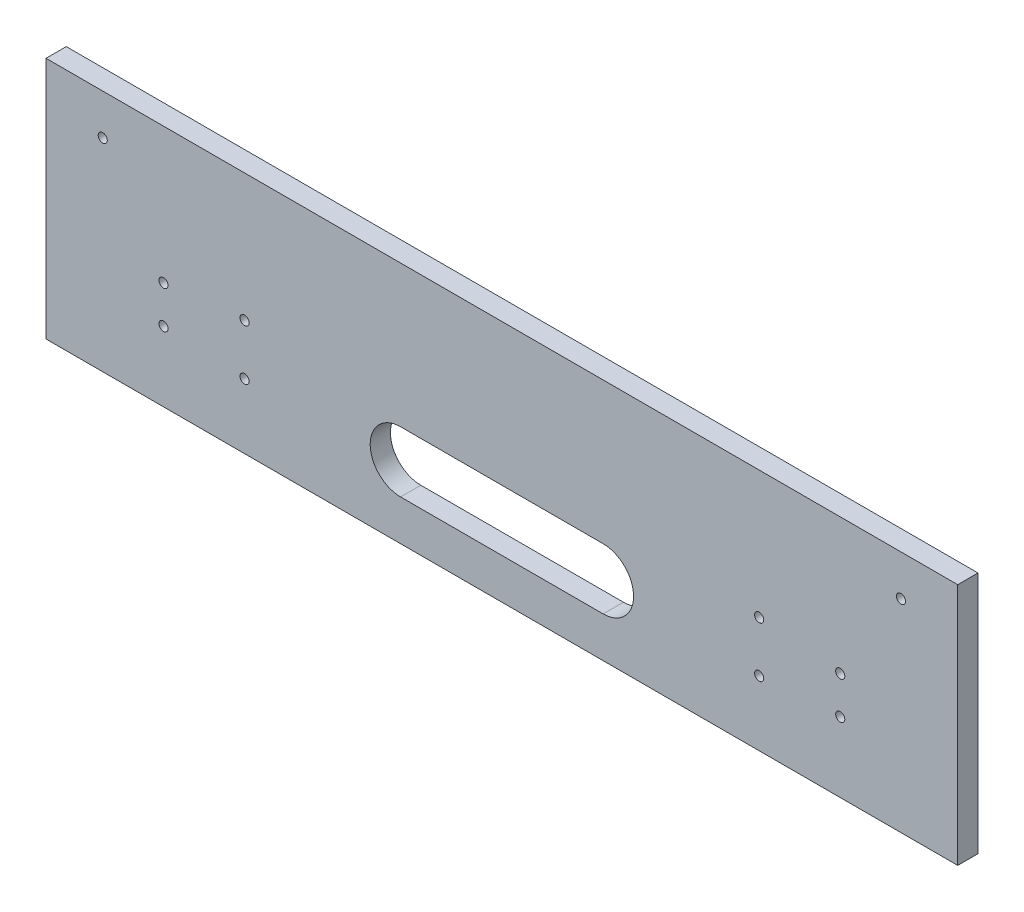
from build123d import *

# Parameters (mm, degrees)
SCHIZZO1_W                   = 450
SCHIZZO1_H                   = 120
ESTRUSIONE_ESTRUSIONE1_DEPTH = 10
TAGLIO_ESTRUSIONE1_DEPTH     = 10
SCHIZZO3_R                   = 2.25
TAGLIO_ESTRUSIONE2_DEPTH     = 10
SCHIZZO4_R                   = 2.25
TAGLIO_ESTRUSIONE3_DEPTH     = 10


with BuildPart() as part:
    # Schizzo1 → Estrusione-Estrusione1 (new body)
    with BuildSketch(Plane.XY):
        Rectangle(SCHIZZO1_W, SCHIZZO1_H)
    extrude(amount=ESTRUSIONE_ESTRUSIONE1_DEPTH)

    # Schizzo2 → Taglio-Estrusione1 (cut)
    with BuildSketch(Plane.XY.offset(10)):
        with BuildLine():
            Line((-50, -10), (50, -10))
            ThreePointArc((50, -10), (65, -25), (50, -40))
            Line((50, -40), (-50, -40))
            ThreePointArc((-50, -40), (-65, -25), (-50, -10))
        make_face()
    extrude(amount=-TAGLIO_ESTRUSIONE1_DEPTH, mode=Mode.SUBTRACT)

    # Schizzo3 → Taglio-Estrusione2 (cut)
    with BuildSketch(Plane(origin=(0, 0, 0), x_dir=(-1, 0, 0), z_dir=(0, 0, -1))):
        with Locations((-167, -7)):
            Circle(SCHIZZO3_R)
        with Locations((-167, -25.5)):
            Circle(SCHIZZO3_R)
        with Locations((167, -7)):
            Circle(SCHIZZO3_R)
        with Locations((167, -25.5)):
            Circle(SCHIZZO3_R)
        with Locations((197, 40)):
            Circle(SCHIZZO3_R)
        with Locations((-197, 40)):
            Circle(SCHIZZO3_R)
    extrude(amount=-TAGLIO_ESTRUSIONE2_DEPTH, mode=Mode.SUBTRACT)

    # Schizzo4 → Taglio-Estrusione3 (cut)
    with BuildSketch(Plane.XY.offset(10)):
        with Locations((-127, -3)):
            Circle(SCHIZZO4_R)
        with Locations((-127, -28)):
            Circle(SCHIZZO4_R)
        with Locations((127, -28)):
            Circle(SCHIZZO4_R)
        with Locations((127, -3)):
            Circle(SCHIZZO4_R)
    extrude(amount=-TAGLIO_ESTRUSIONE3_DEPTH, mode=Mode.SUBTRACT)


solid = part.part
